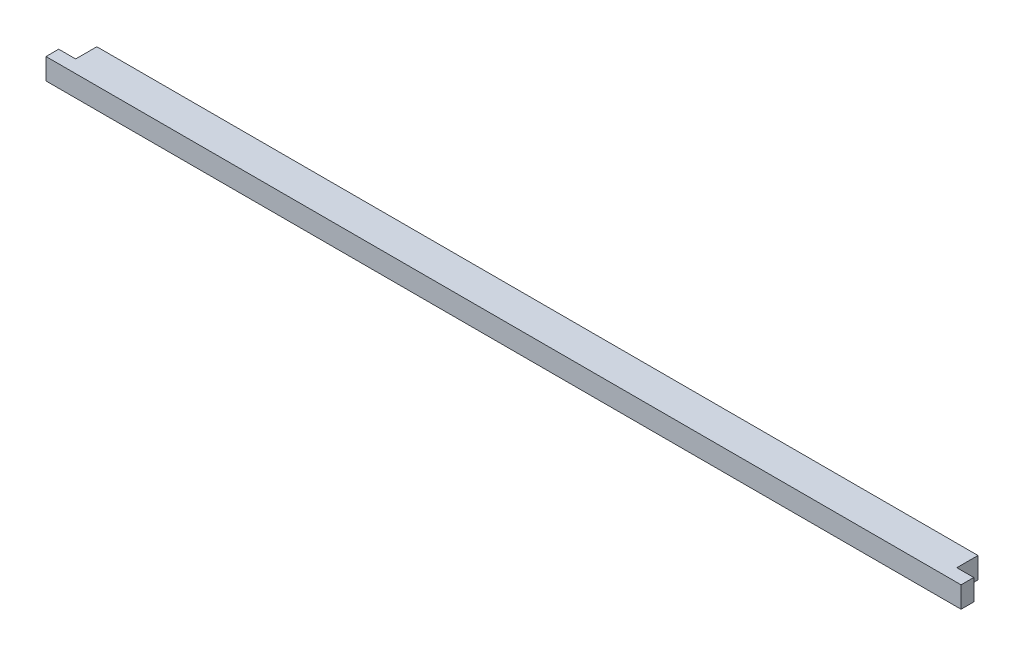
from build123d import *

# Parameters (mm, degrees)
SKETCH1_W           = 432
SKETCH1_H           = 16
BOSS_EXTRUDE2_DEPTH = 10
SKETCH2_W           = 8
SKETCH2_H           = 10
CUT_EXTRUDE3_DEPTH  = 10


with BuildPart() as part:
    # Sketch1 → Boss-Extrude2 (new body)
    with BuildSketch(Plane(origin=(0, 0, 0), x_dir=(1, 0, 0), z_dir=(0, 1, 0))):
        with Locations((216, 8)):
            Rectangle(SKETCH1_W, SKETCH1_H)
    extrude(amount=BOSS_EXTRUDE2_DEPTH)

    # Sketch2 → Cut-Extrude3 (cut)
    with BuildSketch(Plane(origin=(0, 10, 0), x_dir=(1, 0, 0), z_dir=(0, 1, 0))):
        with Locations((428, 11)):
            Rectangle(SKETCH2_W, SKETCH2_H)
        with Locations((4, 11)):
            Rectangle(SKETCH2_W, SKETCH2_H)
    extrude(amount=-CUT_EXTRUDE3_DEPTH, mode=Mode.SUBTRACT)


solid = part.part
